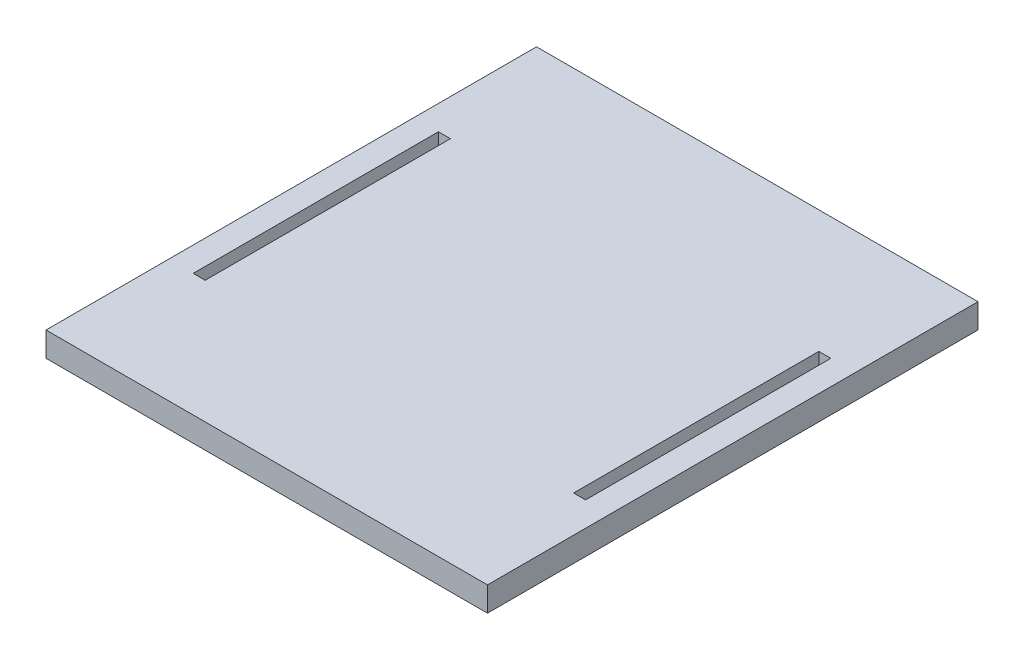
from build123d import *

# Parameters (mm, degrees)
CROQUIS1_W              = 180
CROQUIS1_H              = 200
CROQUIS1_W_2            = 4.9
CROQUIS1_H_2            = 100
SALIENTE_EXTRUIR1_DEPTH = 10


with BuildPart() as part:
    # Croquis1 → Saliente-Extruir1 (new body)
    with BuildSketch(Plane(origin=(0, 0, 0), x_dir=(1, 0, 0), z_dir=(0, 1, 0))):
        Rectangle(CROQUIS1_W, CROQUIS1_H)
        with Locations((-77.55, 0)):
            Rectangle(CROQUIS1_W_2, CROQUIS1_H_2, mode=Mode.SUBTRACT)
        with Locations((77.55, 0)):
            Rectangle(CROQUIS1_W_2, CROQUIS1_H_2, mode=Mode.SUBTRACT)
    extrude(amount=SALIENTE_EXTRUIR1_DEPTH)


solid = part.part
